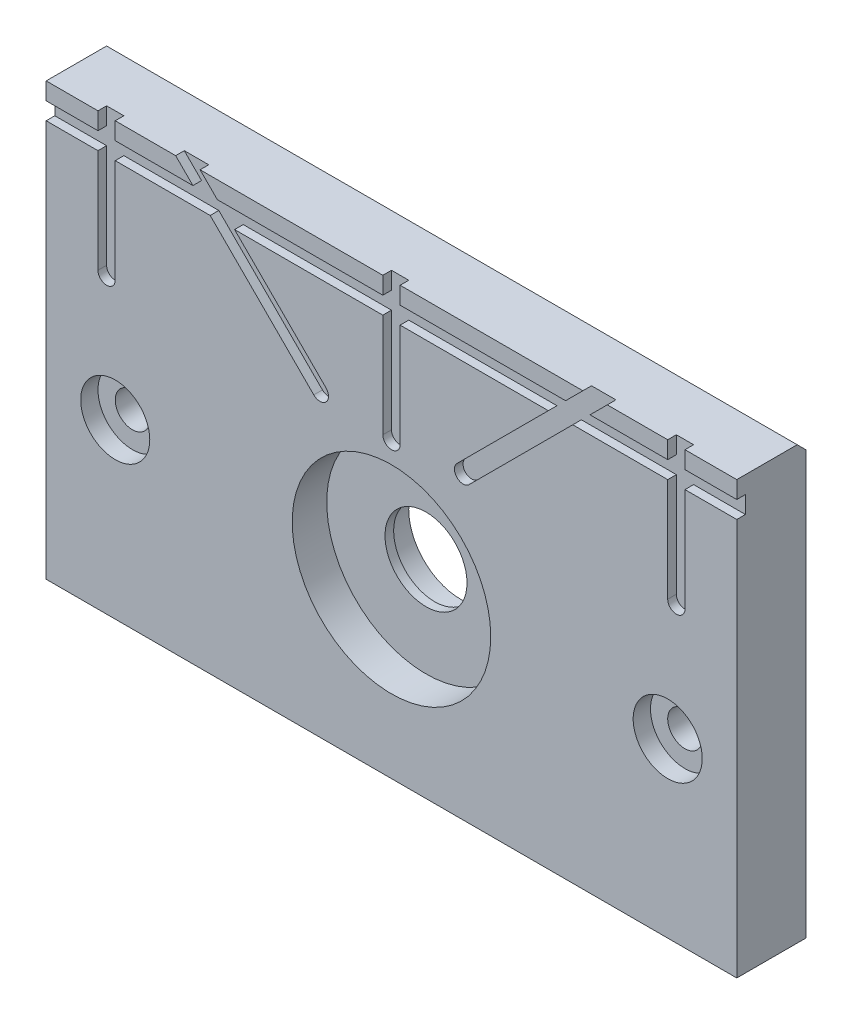
from build123d import *

# Parameters (mm, degrees)
SKETCH_1_W                     = 80
SKETCH_1_H                     = 60
EXTRUDE_1_DEPTH                = 8
HOLE_WIZARD_M3_5_1_D           = 4
HOLE_WIZARD_M3_5_1_CBORE_D     = 8
HOLE_WIZARD_M3_5_1_CBORE_DEPTH = 2
SKETCH_14_W                    = 80
SKETCH_14_H                    = 2
SKETCH_14_W_2                  = 2
SKETCH_14_H_2                  = 16
CUT_EXTRUDE_1_DEPTH            = 1
CUT_EXTRUDE_2_REACH            = 92.174
SKETCH_15_R                    = 4.75
SKETCH_17_R                    = 11.5
CUT_EXTRUDE_4_DEPTH            = 4
SKETCH_18_R                    = 6
CUT_EXTRUDE_5_DEPTH            = 3
CHAMFER_1_SIZE                 = 1.499999999
CHAMFER_1_SIZE2                = 1.500000001
CHAMFER_2_SIZE                 = 1
SKETCH_20_W                    = 80
SKETCH_20_H                    = 6
CUT_EXTRUDE_6_DEPTH            = 1
SKETCH_21_W                    = 80
SKETCH_21_H                    = 4
CUT_EXTRUDE_7_DEPTH            = 1
SKETCH_22_W                    = 80
SKETCH_22_H                    = 2
CUT_EXTRUDE_8_DEPTH            = 1
SKETCH_23_R                    = 1
CUT_EXTRUDE_9_DEPTH            = 1
CUT_EXTRUDE_10_REACH           = 92.174
SKETCH_24_W                    = 80
SKETCH_24_H                    = 10


with BuildPart() as part:
    # 草图1 → 凸台-拉伸1 (new body)
    with BuildSketch(Plane.XY.offset(8)):
        with Locations((40, 10.833333333)):
            Rectangle(SKETCH_1_W, SKETCH_1_H)
    extrude(amount=-EXTRUDE_1_DEPTH)

    # M3.5 六角头机械螺钉的柱形沉头孔1 (through all)
    with Locations(Plane.XY.offset(8)):
        with Locations((8, 10.833333333), (72, 10.833333333)):
            CounterBoreHole(HOLE_WIZARD_M3_5_1_D / 2, HOLE_WIZARD_M3_5_1_CBORE_D / 2, HOLE_WIZARD_M3_5_1_CBORE_DEPTH)

    # 草图14 → 切除-拉伸1 (cut)
    with BuildSketch(Plane.XY.offset(8)):
        with Locations((40, 37.833333333)):
            Rectangle(SKETCH_14_W, SKETCH_14_H)
        Polygon((15, 40.833333333), (31, 24.833333333), (32.414213562, 26.247546896), (16.414213562, 42.247546896), align=None)
        with Locations((7, 32.833333333)):
            Rectangle(SKETCH_14_W_2, SKETCH_14_H_2)
        with Locations((40, 32.833333333)):
            Rectangle(SKETCH_14_W_2, SKETCH_14_H_2)
        with Locations((73, 32.833333333)):
            Rectangle(SKETCH_14_W_2, SKETCH_14_H_2)
        Polygon((47.585786438, 26.247546896), (63.585786438, 42.247546896), (65, 40.833333333), (49, 24.833333333), align=None)
    extrude(amount=-CUT_EXTRUDE_1_DEPTH, mode=Mode.SUBTRACT)

    # 草图15 → 切除-拉伸2 (cut, up to next)
    with BuildSketch(Plane.XY.offset(8), mode=Mode.PRIVATE) as cut_extrude_2_sk1:
        with Locations((40, 10.833333333)):
            Circle(SKETCH_15_R)
    cut_extrude_2_tool1 = extrude(cut_extrude_2_sk1.sketch, amount=-CUT_EXTRUDE_2_REACH, mode=Mode.PRIVATE) & part.part
    add(cut_extrude_2_tool1.solids().sort_by_distance((40, 10.833333, 8))[0], mode=Mode.SUBTRACT)

    # 草图17 → 切除-拉伸4 (cut)
    with BuildSketch(Plane.XY.offset(8)):
        with Locations((40, 10.833333333)):
            Circle(SKETCH_17_R)
    extrude(amount=-CUT_EXTRUDE_4_DEPTH, mode=Mode.SUBTRACT)

    # 草图18 → 切除-拉伸5 (cut)
    with BuildSketch(Plane(origin=(0, 0, 0), x_dir=(-1, 0, 0), z_dir=(0, 0, -1))):
        with Locations((-40, 10.833333333)):
            Circle(SKETCH_18_R)
    extrude(amount=-CUT_EXTRUDE_5_DEPTH, mode=Mode.SUBTRACT)

    # 倒角1
    chamfer_1_edges = [part.edges().sort_by_distance(p)[0] for p in [
        (74, 10.833333333, 0),
        (10, 10.833333333, 0),
    ]]
    chamfer_1_side = [part.faces().sort_by_distance(p)[0] for p in [
        (79, 10.833333333, 0),
    ]]
    chamfer(chamfer_1_edges, length=CHAMFER_1_SIZE, length2=CHAMFER_1_SIZE2, reference=chamfer_1_side[0])

    # 倒角2
    chamfer_2_edges = [part.edges().sort_by_distance(p)[0] for p in [
        (40, 40.833333333, 0),
    ]]
    chamfer(chamfer_2_edges, length=CHAMFER_2_SIZE)

    # 草图20 → 切除-拉伸6 (cut)
    with BuildSketch(Plane.XY.offset(8)):
        with Locations((40, -16.166666667)):
            Rectangle(SKETCH_20_W, SKETCH_20_H)
    extrude(amount=-CUT_EXTRUDE_6_DEPTH, mode=Mode.SUBTRACT)

    # 草图21 → 切除-拉伸7 (cut)
    with BuildSketch(Plane.XY.offset(7)):
        with Locations((40, -17.166666667)):
            Rectangle(SKETCH_21_W, SKETCH_21_H)
    extrude(amount=-CUT_EXTRUDE_7_DEPTH, mode=Mode.SUBTRACT)

    # 草图22 → 切除-拉伸8 (cut)
    with BuildSketch(Plane.XY.offset(6)):
        with Locations((40, -18.166666667)):
            Rectangle(SKETCH_22_W, SKETCH_22_H)
    extrude(amount=-CUT_EXTRUDE_8_DEPTH, mode=Mode.SUBTRACT)

    # 草图23 → 切除-拉伸9 (cut)
    with BuildSketch(Plane.XY.offset(8)):
        with Locations((7, 24.833333333)):
            Circle(SKETCH_23_R)
        with Locations((31.707106781, 25.540440115)):
            Circle(SKETCH_23_R)
        with Locations((40, 24.833333333)):
            Circle(SKETCH_23_R)
        with Locations((48.292893219, 25.540440115)):
            Circle(SKETCH_23_R)
        with Locations((73, 24.833333333)):
            Circle(SKETCH_23_R)
    extrude(amount=-CUT_EXTRUDE_9_DEPTH, mode=Mode.SUBTRACT)

    # 草图24 → 切除-拉伸10 (cut, up to next)
    with BuildSketch(Plane.XY.offset(8), mode=Mode.PRIVATE) as cut_extrude_10_sk1:
        with Locations((40, -14.166666667)):
            Rectangle(SKETCH_24_W, SKETCH_24_H)
    cut_extrude_10_tool1 = extrude(cut_extrude_10_sk1.sketch, amount=-CUT_EXTRUDE_10_REACH, mode=Mode.PRIVATE) & part.part
    add(cut_extrude_10_tool1.solids().sort_by_distance((40, -14.166667, 8))[0], mode=Mode.SUBTRACT)


solid = part.part
